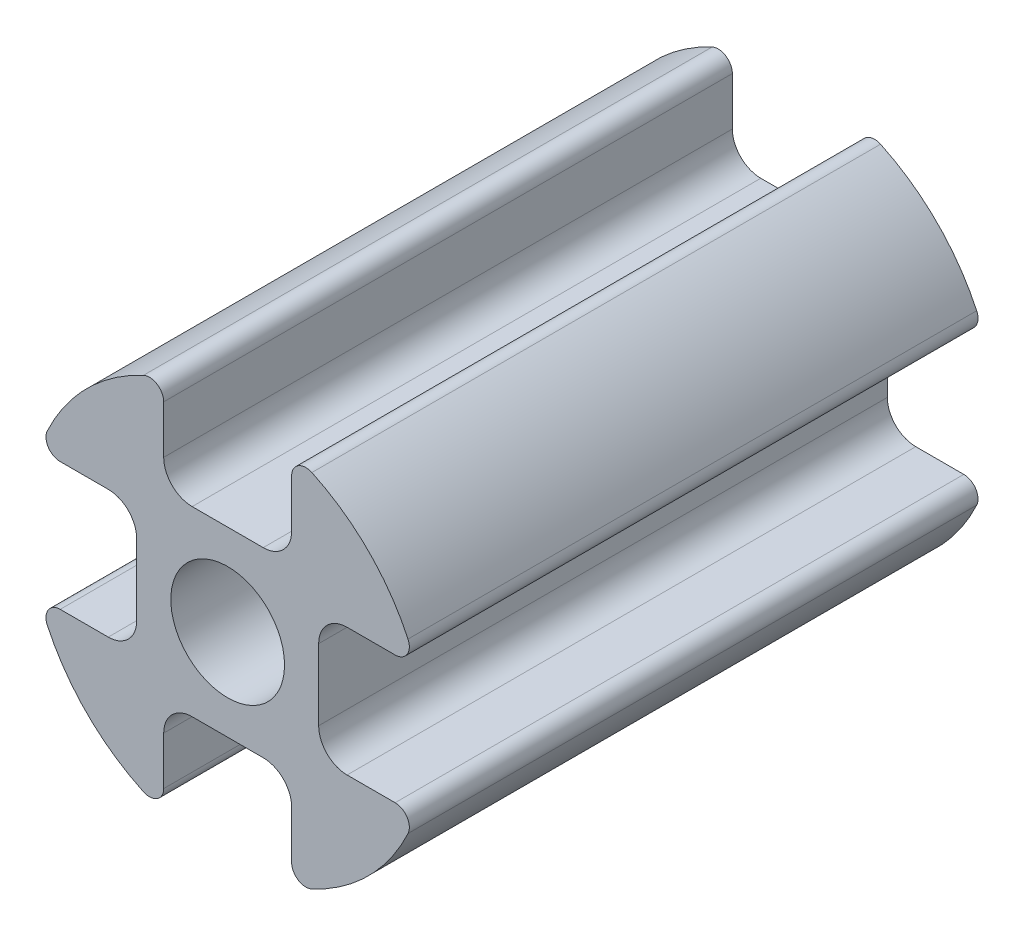
from build123d import *

# Parameters (mm, degrees)
SKETCH_2_R          = 7
EXTRUDE_1_DEPTH     = 20
SKETCH_4_W          = 4.5
SKETCH_4_H          = 3.8
SKETCH_4_W_2        = 3.8
SKETCH_4_H_2        = 4.5
CUT_EXTRUDE_1_DEPTH = 20
SKETCH_5_R          = 2
CUT_EXTRUDE_2_DEPTH = 20
FILLET_1_R          = 1
FILLET_2_R          = 0.5


with BuildPart() as part:
    # 草图2 → 凸台-拉伸1 (new body)
    with BuildSketch(Plane.XY):
        Circle(SKETCH_2_R)
    extrude(amount=EXTRUDE_1_DEPTH)

    # 草图4 → 切除-拉伸1 (cut)
    with BuildSketch(Plane.XY.offset(20)):
        with Locations((0, 5.1)):
            Rectangle(SKETCH_4_W, SKETCH_4_H)
        with Locations((5.1, 0)):
            Rectangle(SKETCH_4_W_2, SKETCH_4_H_2)
        with Locations((0, -5.1)):
            Rectangle(SKETCH_4_W, SKETCH_4_H)
        with Locations((-5.1, 0)):
            Rectangle(SKETCH_4_W_2, SKETCH_4_H_2)
    extrude(amount=-CUT_EXTRUDE_1_DEPTH, mode=Mode.SUBTRACT)

    # 草图5 → 切除-拉伸2 (cut)
    with BuildSketch(Plane.XY.offset(20)):
        Circle(SKETCH_5_R)
    extrude(amount=-CUT_EXTRUDE_2_DEPTH, mode=Mode.SUBTRACT)

    # 圆角1
    fillet_1_edges = [part.edges().sort_by_distance(p)[0] for p in [
        (-2.25, 3.2, 10),
        (2.25, 3.2, 10),
        (3.2, 2.25, 10),
        (3.2, -2.25, 10),
        (2.25, -3.2, 10),
        (-2.25, -3.2, 10),
        (-3.2, -2.25, 10),
        (-3.2, 2.25, 10),
    ]]
    fillet(fillet_1_edges, radius=FILLET_1_R)

    # 圆角2
    fillet_2_edges = [part.edges().sort_by_distance(p)[0] for p in [
        (-2.25, 6.628536792, 10),
        (2.25, 6.628536792, 10),
        (6.628536792, -2.25, 10),
        (6.628536792, 2.25, 10),
        (2.25, -6.628536792, 10),
        (-2.25, -6.628536792, 10),
        (-6.628536792, 2.25, 10),
        (-6.628536792, -2.25, 10),
    ]]
    fillet(fillet_2_edges, radius=FILLET_2_R)


solid = part.part
